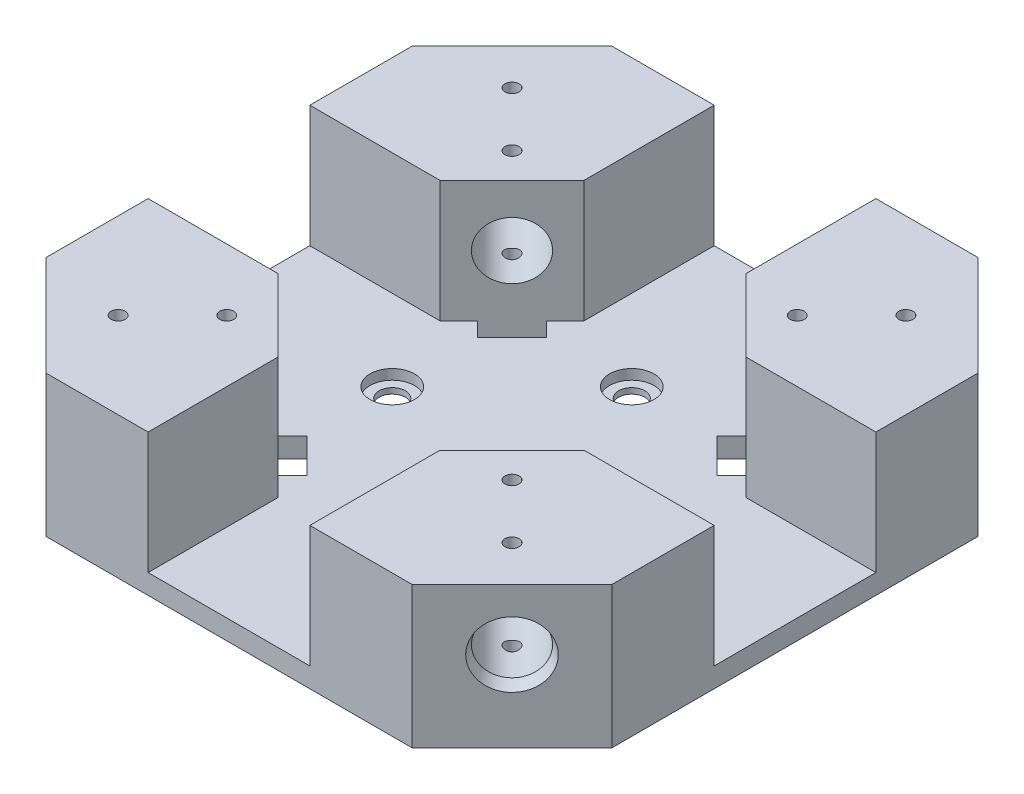
from build123d import *
from OCP.BRepFilletAPI import BRepFilletAPI_MakeChamfer

# Parameters (mm, degrees)
ESTRUSIONE_ESTRUSIONE2_DEPTH = 35
SCHIZZO2_W                   = 50
SCHIZZO2_H                   = 40
SCHIZZO2_W_2                 = 40
SCHIZZO2_H_2                 = 50
TAGLIO_ESTRUSIONE1_DEPTH     = 30.1
SCHIZZO3_R                   = 7.1
TAGLIO_ESTRUSIONE2_DEPTH     = 193.425993797
SCHIZZO4_R                   = 7.1
TAGLIO_ESTRUSIONE3_DEPTH     = 184.8698693
TAGLIO_ESTRUSIONE4_DEPTH     = 30.1
TAGLIO_ESTRUSIONE5_DEPTH     = 159.695875371
SCHIZZO9_R                   = 1.75
TAGLIO_ESTRUSIONE6_DEPTH     = 160.697748449
TAGLIO_ESTRUSIONE7_REACH     = 161.698
SCHIZZO10_R                  = 3.25
SMUSSO2_SIZE                 = 2
SMUSSO2_SIZE2                = 1
SCHIZZO11_R                  = 5.5
TAGLIO_ESTRUSIONE8_DEPTH     = 2.5
SMUSSO3_SIZE                 = 3
SMUSSO3_SIZE2                = 1
SMUSSO4_SIZE                 = 1
SMUSSO4_SIZE2                = 3


with BuildPart() as part:
    # Schizzo1 → Estrusione-Estrusione2 (new body)
    with BuildSketch(Plane(origin=(0, 0, 0), x_dir=(1, 0, 0), z_dir=(0, 1, 0))):
        Polygon((-28.030556024, -6.894377895), (-3.281818683, -31.643115237), (87.220706634, -31.643115237), (111.969443976, -6.894377895), (111.969443976, 83.608147422), (87.220706634, 108.356884763), (-3.281818683, 108.356884763), (-28.030556024, 83.608147422), align=None)
    extrude(amount=ESTRUSIONE_ESTRUSIONE2_DEPTH)

    # Schizzo2 → Taglio-Estrusione1 (cut)
    with BuildSketch(Plane(origin=(0, 35, 0), x_dir=(1, 0, 0), z_dir=(0, 1, 0))):
        with Locations((86.969443976, 38.356884763)):
            Rectangle(SCHIZZO2_W, SCHIZZO2_H)
        with Locations((41.969443976, 38.356884763)):
            Rectangle(SCHIZZO2_W_2, SCHIZZO2_H)
        with Locations((41.969443976, 83.356884763)):
            Rectangle(SCHIZZO2_W_2, SCHIZZO2_H_2)
        with Locations((-3.030556024, 38.356884763)):
            Rectangle(SCHIZZO2_W, SCHIZZO2_H)
        with Locations((41.969443976, -6.643115237)):
            Rectangle(SCHIZZO2_W_2, SCHIZZO2_H_2)
    extrude(amount=-TAGLIO_ESTRUSIONE1_DEPTH, mode=Mode.SUBTRACT)

    # Schizzo3 → Taglio-Estrusione2 (cut, through all)
    with BuildSketch(Plane(origin=(59.431910936, 0, 59.431910936), x_dir=(0.7071067811865498, 0, -0.7071067811865452), z_dir=(0.7071067811865452, 0, 0.7071067811865498))):
        with Locations((56.799291759, 19.95)):
            Circle(SCHIZZO3_R)
    extrude(amount=-TAGLIO_ESTRUSIONE2_DEPTH, mode=Mode.SUBTRACT)

    # Schizzo4 → Taglio-Estrusione3 (cut, through all)
    with BuildSketch(Plane(origin=(97.788795699, 0, -97.788795699), x_dir=(-0.7071067811865509, 0, -0.7071067811865441), z_dir=(0.7071067811865441, 0, -0.7071067811865509))):
        with Locations((-2.554465117, 19.95)):
            Circle(SCHIZZO4_R)
    extrude(amount=-TAGLIO_ESTRUSIONE3_DEPTH, mode=Mode.SUBTRACT)

    # Schizzo6 → Taglio-Estrusione4 (cut)
    with BuildSketch(Plane(origin=(0, 35, 0), x_dir=(1, 0, 0), z_dir=(0, 1, 0))):
        Polygon((21.969443976, 0.537793877), (4.15035309, 18.356884763), (21.969443976, 18.356884763), align=None)
        Polygon((4.15035309, 58.356884763), (21.969443976, 76.175975649), (21.969443976, 58.356884763), align=None)
        Polygon((61.969443976, 76.175975649), (79.788534862, 58.356884763), (61.969443976, 58.356884763), align=None)
        Polygon((79.788534862, 18.356884763), (61.969443976, 0.537793877), (61.969443976, 18.356884763), align=None)
    extrude(amount=-TAGLIO_ESTRUSIONE4_DEPTH, mode=Mode.SUBTRACT)

    # Schizzo7 → Taglio-Estrusione5 (cut, through all)
    with BuildSketch(Plane(origin=(0, 4.9, 0), x_dir=(1, 0, 0), z_dir=(0, 1, 0))):
        Polygon((8.817257846, 13.689980007), (17.30253922, 5.204698633), (20.838073126, 8.740232539), (12.352791752, 17.225513913), align=None)
        Polygon((17.30253922, 71.509070893), (8.817257846, 63.023789519), (12.352791752, 59.488255613), (20.838073126, 67.973536987), align=None)
        Polygon((75.121630106, 63.023789519), (66.636348732, 71.509070893), (63.100814826, 67.973536987), (71.5860962, 59.488255613), align=None)
        Polygon((66.636348732, 5.204698633), (75.121630106, 13.689980007), (71.5860962, 17.225513913), (63.100814826, 8.740232539), align=None)
    extrude(amount=-TAGLIO_ESTRUSIONE5_DEPTH, mode=Mode.SUBTRACT)

    # Schizzo9 → Taglio-Estrusione6 (cut, through all)
    with BuildSketch(Plane(origin=(0, 35, 0), x_dir=(1, 0, 0), z_dir=(0, 1, 0))):
        with Locations(Location((90.677979292, 87.065420079, 0), (0, 0, 270))):
            Circle(SCHIZZO9_R)
        with Locations(Location((77.242950449, 73.630391237, 0), (0, 0, 270))):
            Circle(SCHIZZO9_R)
        with Locations(Location((90.677979292, -10.351650553, 0), (0, 0, 270))):
            Circle(SCHIZZO9_R)
        with Locations(Location((77.242950449, 3.08337829, 0), (0, 0, 270))):
            Circle(SCHIZZO9_R)
        with Locations(Location((-6.73909134, -10.351650553, 0), (0, 0, 270))):
            Circle(SCHIZZO9_R)
        with Locations(Location((6.695937502, 3.08337829, 0), (0, 0, 270))):
            Circle(SCHIZZO9_R)
        with Locations(Location((-6.73909134, 87.065420079, 0), (0, 0, 270))):
            Circle(SCHIZZO9_R)
        with Locations(Location((6.695937502, 73.630391237, 0), (0, 0, 270))):
            Circle(SCHIZZO9_R)
    extrude(amount=-TAGLIO_ESTRUSIONE6_DEPTH, mode=Mode.SUBTRACT)

    # Schizzo10 → Taglio-Estrusione7 (cut, up to next)
    with BuildSketch(Plane.XZ, mode=Mode.PRIVATE) as taglio_estrusione7_sk1:
        with Locations(Location((71.5860962, -38.356884763, 0), (0, 0, 270))):
            Circle(SCHIZZO10_R)
    taglio_estrusione7_tool1 = extrude(taglio_estrusione7_sk1.sketch, amount=-TAGLIO_ESTRUSIONE7_REACH, mode=Mode.PRIVATE) & part.part
    # Schizzo10 → Taglio-Estrusione7 (cut, up to next)
    with BuildSketch(Plane.XZ, mode=Mode.PRIVATE) as taglio_estrusione7_sk2:
        with Locations(Location((12.352791752, -38.356884763, 0), (0, 0, 270))):
            Circle(SCHIZZO10_R)
    taglio_estrusione7_tool2 = extrude(taglio_estrusione7_sk2.sketch, amount=-TAGLIO_ESTRUSIONE7_REACH, mode=Mode.PRIVATE) & part.part
    # Schizzo10 → Taglio-Estrusione7 (cut, up to next)
    with BuildSketch(Plane.XZ, mode=Mode.PRIVATE) as taglio_estrusione7_sk3:
        with Locations(Location((41.969443976, -67.973536987, 0), (0, 0, 270))):
            Circle(SCHIZZO10_R)
    taglio_estrusione7_tool3 = extrude(taglio_estrusione7_sk3.sketch, amount=-TAGLIO_ESTRUSIONE7_REACH, mode=Mode.PRIVATE) & part.part
    # Schizzo10 → Taglio-Estrusione7 (cut, up to next)
    with BuildSketch(Plane.XZ, mode=Mode.PRIVATE) as taglio_estrusione7_sk4:
        with Locations(Location((41.969443976, -8.740232539, 0), (0, 0, 270))):
            Circle(SCHIZZO10_R)
    taglio_estrusione7_tool4 = extrude(taglio_estrusione7_sk4.sketch, amount=-TAGLIO_ESTRUSIONE7_REACH, mode=Mode.PRIVATE) & part.part
    add(taglio_estrusione7_tool1.solids().sort_by_distance((71.586096, 0, -38.356885))[0], mode=Mode.SUBTRACT)
    add(taglio_estrusione7_tool2.solids().sort_by_distance((12.352792, 0, -38.356885))[0], mode=Mode.SUBTRACT)
    add(taglio_estrusione7_tool3.solids().sort_by_distance((41.969444, 0, -67.973537))[0], mode=Mode.SUBTRACT)
    add(taglio_estrusione7_tool4.solids().sort_by_distance((41.969444, 0, -8.740233))[0], mode=Mode.SUBTRACT)

    # Smusso2
    smusso2_edges = [part.edges().sort_by_distance(p)[0] for p in [
        (71.5860962, 0, -35.106884763),
        (12.352791752, 0, -35.106884763),
        (41.969443976, 0, -64.723536987),
        (41.969443976, 0, -5.490232539),
    ]]
    smusso2_side = [part.faces().sort_by_distance(p)[0] for p in [
        (41.969443976, 0, -38.356884763),
    ]]
    chamfer(smusso2_edges, length=SMUSSO2_SIZE, length2=SMUSSO2_SIZE2, reference=smusso2_side[0])

    # Schizzo11 → Taglio-Estrusione8 (cut)
    with BuildSketch(Plane(origin=(0, 4.9, 0), x_dir=(1, 0, 0), z_dir=(0, 1, 0))):
        with Locations(Location((41.969443976, 8.740232539, 0), (0, 0, 270))):
            Circle(SCHIZZO11_R)
        with Locations(Location((71.5860962, 38.356884763, 0), (0, 0, 270))):
            Circle(SCHIZZO11_R)
        with Locations(Location((12.352791752, 38.356884763, 0), (0, 0, 270))):
            Circle(SCHIZZO11_R)
        with Locations(Location((41.969443976, 67.973536987, 0), (0, 0, 270))):
            Circle(SCHIZZO11_R)
    extrude(amount=-TAGLIO_ESTRUSIONE8_DEPTH, mode=Mode.SUBTRACT)

    # Smusso3: one chamfer whose edges measure the first distance from different faces: ONE call of the kernel's chamfer builder (chamfer() names one face for all edges)
    smusso3_edges_1 = [part.edges().sort_by_distance(p)[0] for p in [
        (-20.6766455, 19.95, -90.962057946),
    ]]
    smusso3_side_1 = [part.faces().sort_by_distance(p)[0] for p in [
        (-6.318602557, 19.95, -76.604015003),
    ]]
    smusso3_edges_2 = [part.edges().sort_by_distance(p)[0] for p in [
        (-10.635729207, 19.95, 24.289204713),
    ]]
    smusso3_side_2 = [part.faces().sort_by_distance(p)[0] for p in [
        (3.722313736, 19.95, 9.931161769),
    ]]
    smusso3 = BRepFilletAPI_MakeChamfer(part.part.solid().wrapped)
    for e in smusso3_edges_1:
        smusso3.Add(SMUSSO3_SIZE, SMUSSO3_SIZE2, e.wrapped, smusso3_side_1[0].wrapped)  # the first distance lies on this face
    for e in smusso3_edges_2:
        smusso3.Add(SMUSSO3_SIZE, SMUSSO3_SIZE2, e.wrapped, smusso3_side_2[0].wrapped)  # the first distance lies on this face
    add(Compound.cast(smusso3.Shape()), mode=Mode.REPLACE)

    # Smusso4: one chamfer whose edges measure the first distance from different faces: ONE call of the kernel's chamfer builder (chamfer() names one face for all edges)
    smusso4_edges_1 = [part.edges().sort_by_distance(p)[0] for p in [
        (94.574617159, 19.95, 24.289204713),
    ]]
    smusso4_side_1 = [part.faces().sort_by_distance(p)[0] for p in [
        (87.570706634, 17.5, 31.293115237),
    ]]
    smusso4_edges_2 = [part.edges().sort_by_distance(p)[0] for p in [
        (104.615533451, 19.95, -90.962057946),
    ]]
    smusso4_side_2 = [part.faces().sort_by_distance(p)[0] for p in [
        (111.619443976, 17.5, -83.958147422),
    ]]
    smusso4 = BRepFilletAPI_MakeChamfer(part.part.solid().wrapped)
    for e in smusso4_edges_1:
        smusso4.Add(SMUSSO4_SIZE, SMUSSO4_SIZE2, e.wrapped, smusso4_side_1[0].wrapped)  # the first distance lies on this face
    for e in smusso4_edges_2:
        smusso4.Add(SMUSSO4_SIZE, SMUSSO4_SIZE2, e.wrapped, smusso4_side_2[0].wrapped)  # the first distance lies on this face
    add(Compound.cast(smusso4.Shape()), mode=Mode.REPLACE)


solid = part.part
